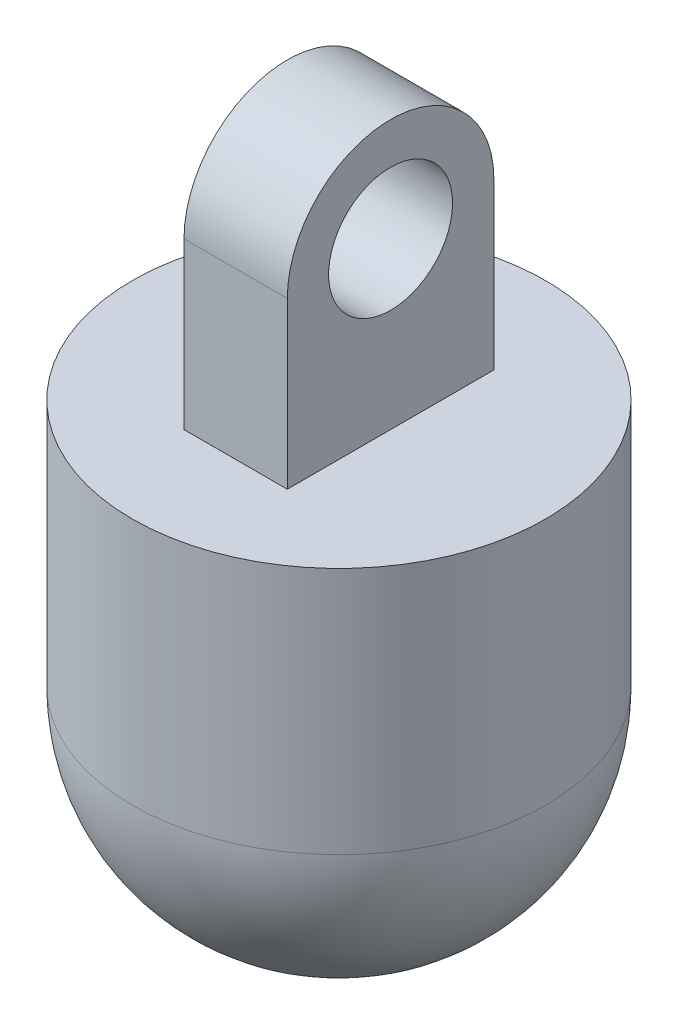
from build123d import *

# Parameters (mm, degrees)
SKETCH1_R           = 50
BOSS_EXTRUDE1_DEPTH = 60
SKETCH2_R           = 15
BOSS_EXTRUDE2_DEPTH = 12.5
DOME1_FACE_RADIUS   = 50
DOME1_HEIGHT        = 50


with BuildPart() as part:
    # Sketch1 → Boss-Extrude1 (new body)
    with BuildSketch(Plane(origin=(0, 0, 0), x_dir=(1, 0, 0), z_dir=(0, 1, 0))):
        with Locations(Location((0, 0, 0), (0, 0, 270))):
            Circle(SKETCH1_R)
    extrude(amount=BOSS_EXTRUDE1_DEPTH)

    # Sketch2 → Boss-Extrude2 (add, symmetric)
    with BuildSketch(Plane(origin=(0, 0, 0), x_dir=(0, 0, -1), z_dir=(1, 0, 0))):
        with BuildLine():
            Line((-25, 100), (-25, 60))
            Line((-25, 60), (25, 60))
            Line((25, 60), (25, 100))
            ThreePointArc((25, 100), (0, 125), (-25, 100))
        make_face()
        with Locations((0, 100)):
            Circle(SKETCH2_R, mode=Mode.SUBTRACT)
    extrude(amount=BOSS_EXTRUDE2_DEPTH, both=True)

    # Dome1: a dome of height H over a round flat face of radius A is a cap of a sphere of radius (A * A + H * H) / (2 * H)
    dome1_r = (DOME1_FACE_RADIUS * DOME1_FACE_RADIUS + DOME1_HEIGHT * DOME1_HEIGHT) / (2 * DOME1_HEIGHT)
    dome1_base = Plane((0, 0, 0), z_dir=(0, -1, 0))
    with Locations(dome1_base.offset(DOME1_HEIGHT - dome1_r)):
        dome1_ball = Sphere(dome1_r, mode=Mode.PRIVATE)
    add(split(dome1_ball, bisect_by=dome1_base, keep=Keep.TOP, mode=Mode.PRIVATE))


solid = part.part
